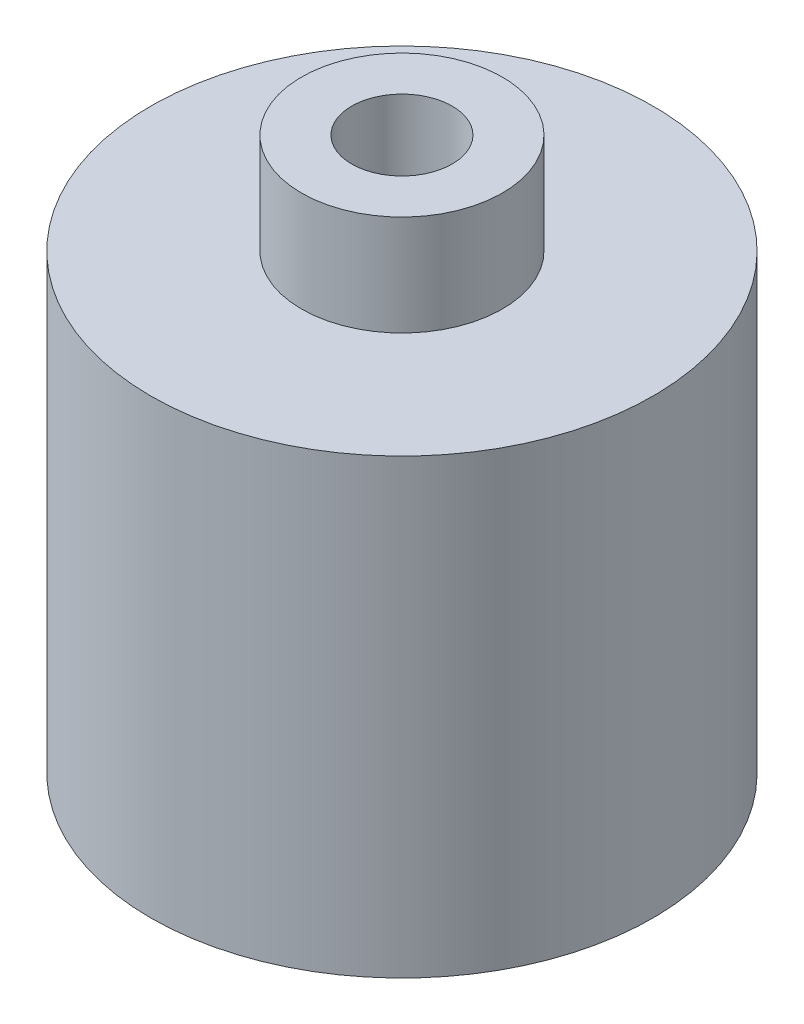
from build123d import *

# Parameters (mm, degrees)
SKETCH1_R           = 15.875
SKETCH1_R_2         = 12.7
BOSS_EXTRUDE1_DEPTH = 25.4
SKETCH2_R           = 15.875
SKETCH2_R_2         = 3.175
BOSS_EXTRUDE2_DEPTH = 3.175
SKETCH3_R           = 6.35
SKETCH3_R_2         = 3.175
BOSS_EXTRUDE3_DEPTH = 6.35


with BuildPart() as part:
    # Sketch1 → Boss-Extrude1 (new body)
    with BuildSketch(Plane(origin=(0, 0, 0), x_dir=(1, 0, 0), z_dir=(0, 1, 0))):
        with Locations(Location((0, 0, 0), (0, 0, 270))):
            Circle(SKETCH1_R)
        with Locations(Location((0, 0, 0), (0, 0, 270))):
            Circle(SKETCH1_R_2, mode=Mode.SUBTRACT)
    extrude(amount=BOSS_EXTRUDE1_DEPTH)

    # Sketch2 → Boss-Extrude2 (add)
    with BuildSketch(Plane(origin=(0, 25.4, 0), x_dir=(1, 0, 0), z_dir=(0, 1, 0))):
        with Locations(Location((0, 0, 0), (0, 0, 270))):
            Circle(SKETCH2_R)
        with Locations(Location((0, 0, 0), (0, 0, 270))):
            Circle(SKETCH2_R_2, mode=Mode.SUBTRACT)
    extrude(amount=BOSS_EXTRUDE2_DEPTH)

    # Sketch3 → Boss-Extrude3 (add)
    with BuildSketch(Plane(origin=(0, 28.575, 0), x_dir=(1, 0, 0), z_dir=(0, 1, 0))):
        with Locations(Location((0, 0, 0), (0, 0, 270))):
            Circle(SKETCH3_R)
        with Locations(Location((0, 0, 0), (0, 0, 270))):
            Circle(SKETCH3_R_2, mode=Mode.SUBTRACT)
    extrude(amount=BOSS_EXTRUDE3_DEPTH)


solid = part.part
